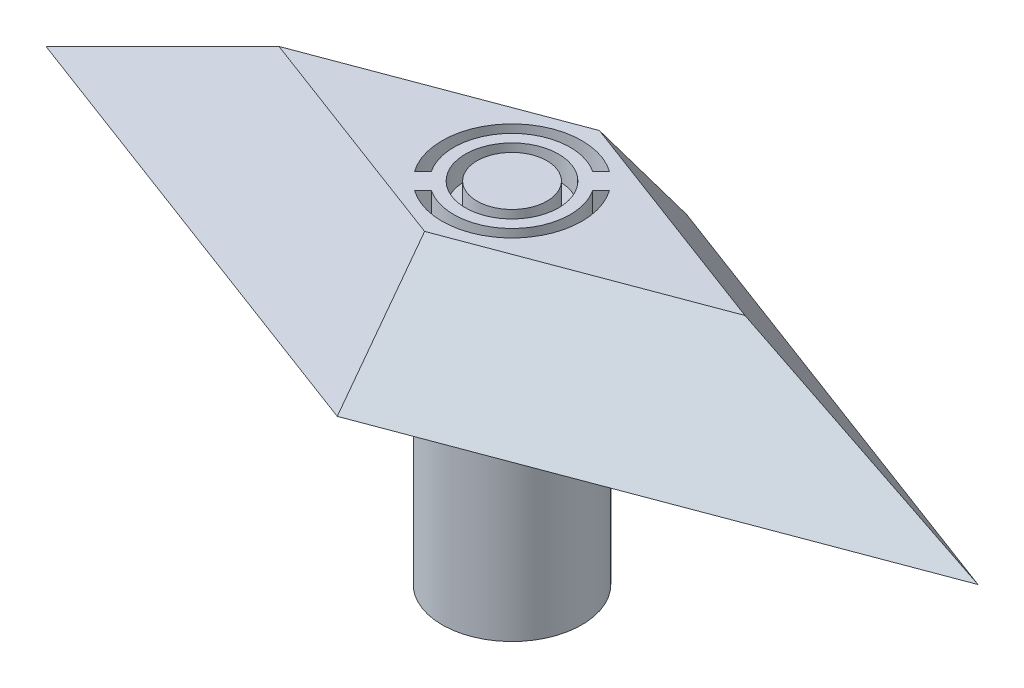
from build123d import *

# Parameters (mm, degrees)
BOSS_EXTRUDE1_DEPTH = 10
CUT_EXTRUDE1_DEPTH  = 1
SKETCH7_R           = 2
SKETCH7_R_2         = 1.5
CUT_EXTRUDE2_DEPTH  = 1


with BuildPart() as part:
    # Sketch1 → Loft1 section 0
    with BuildSketch(Plane(origin=(0, 0, 0), x_dir=(1, 0, 0), z_dir=(0, 1, 0))):
        with BuildLine():
            Line((-20, 0), (0, 7.5))
            Line((0, 7.5), (20, 0))
            Line((20, 0), (0, -7.5))
            Line((0, -7.5), (-20, 0))
        make_face()
    # Sketch3 → Loft1 section 1
    with BuildSketch(Plane(origin=(0, 5, 0), x_dir=(-1, 0, 0), z_dir=(0, -1, 0))):
        with BuildLine():
            Line((0, 3.75), (-10, 0))
            Line((-10, 0), (0, -3.75))
            Line((0, -3.75), (10, 0))
            Line((10, 0), (0, 3.75))
        make_face()
    loft()

    # Sketch5 → Boss-Extrude1 (add)
    with BuildSketch(Plane(origin=(0, 0, 0), x_dir=(1, 0, 0), z_dir=(0, 1, 0))):
        with BuildLine():
            Line((-2, -2.236067977), (-2, 2.236067977))
            ThreePointArc((-2, 2.236067977), (3, 0), (-2, -2.236067977))
        make_face()
    extrude(amount=-BOSS_EXTRUDE1_DEPTH)

    # Sketch6 → Cut-Extrude1 (cut)
    with BuildSketch(Plane(origin=(0, 5, 0), x_dir=(-1, 0, 0), z_dir=(0, -1, 0))):
        with BuildLine():
            Line((-1.738096676, 2.445203457), (-1.378497417, 2.085604198))
            ThreePointArc((-1.378497417, 2.085604198), (1.767766953, 1.767766953), (2.085604198, -1.378497417))
            Line((2.085604198, -1.378497417), (2.445203457, -1.738096676))
            ThreePointArc((2.445203457, -1.738096676), (2.121320344, 2.121320344), (-1.738096676, 2.445203457))
        make_face()
        with BuildLine():
            Line((-2.445203457, 1.738096676), (-2.085604198, 1.378497417))
            ThreePointArc((-2.085604198, 1.378497417), (-1.767766953, -1.767766953), (1.378497417, -2.085604198))
            Line((1.378497417, -2.085604198), (1.738096676, -2.445203457))
            ThreePointArc((1.738096676, -2.445203457), (-2.121320344, -2.121320344), (-2.445203457, 1.738096676))
        make_face()
    extrude(amount=CUT_EXTRUDE1_DEPTH, mode=Mode.SUBTRACT)

    # Sketch7 → Cut-Extrude2 (cut)
    with BuildSketch(Plane(origin=(0, 5, 0), x_dir=(-1, 0, 0), z_dir=(0, -1, 0))):
        with Locations(Location((0, 0, 0), (0, 0, 180))):
            Circle(SKETCH7_R)
        with Locations(Location((0, 0, 0), (0, 0, 180))):
            Circle(SKETCH7_R_2, mode=Mode.SUBTRACT)
    extrude(amount=CUT_EXTRUDE2_DEPTH, mode=Mode.SUBTRACT)


solid = part.part
